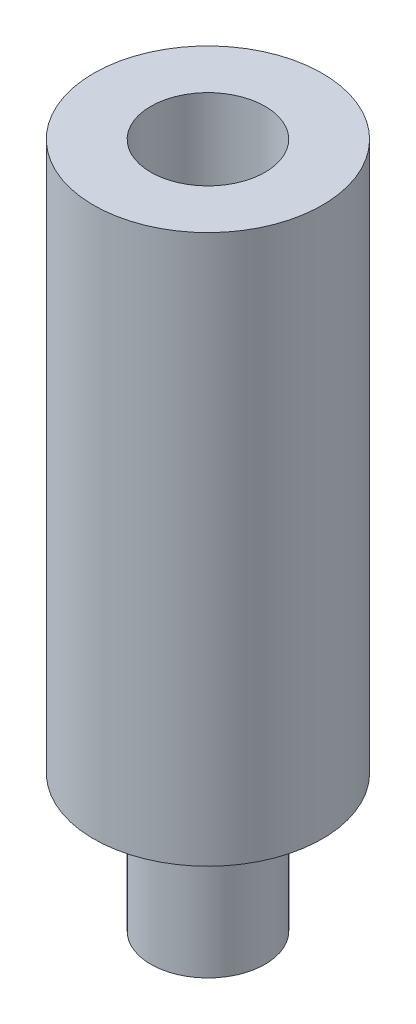
from build123d import *


with BuildPart() as part:
    # Sketch1 → Revolve2 (revolve)
    with BuildSketch(Plane.XY, mode=Mode.PRIVATE) as revolve2_sk:
        Polygon((3.175, 0), (3.175, -15.24), (1.5875, -15.24), (1.5875, -19.05), (0, -19.05), (0, -3.81), (1.5875, -3.81), (1.5875, 0), align=None)
    revolve(revolve2_sk.sketch.rotate(Axis((0, -3.81, 0), (0, -1, 0)), 180), axis=Axis((0, -3.81, 0), (0, -1, 0)))


solid = part.part
